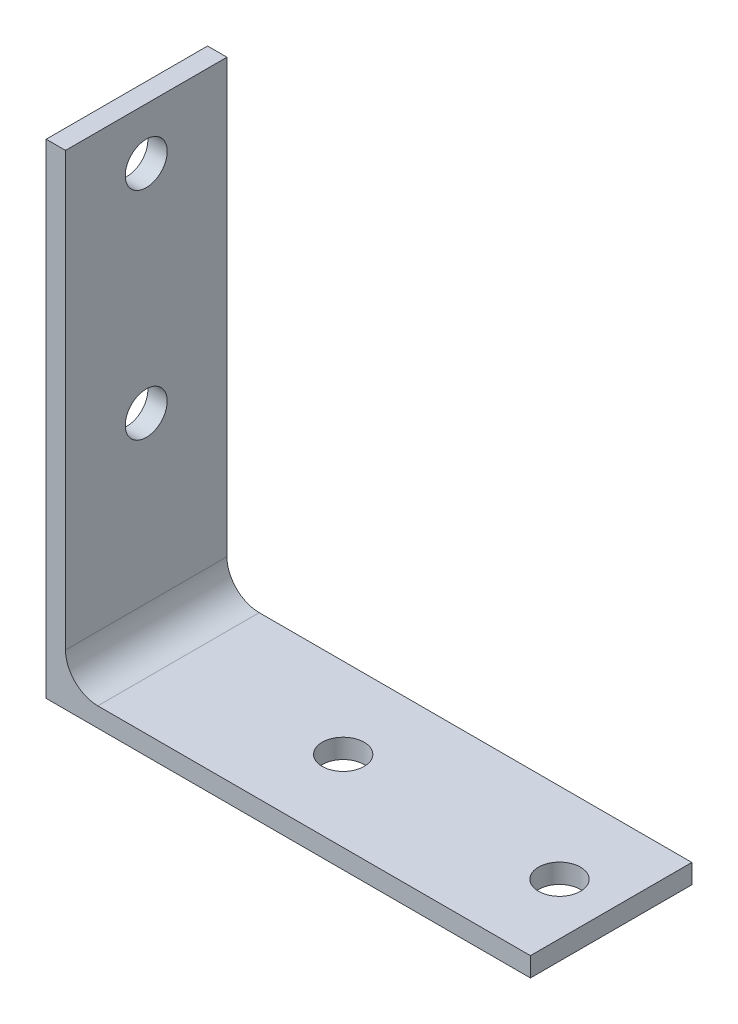
from build123d import *

# Parameters (mm, degrees)
BOSS_EXTRUDE1_DEPTH = 6.35
FILLET1_R           = 2.54
SKETCH2_R           = 1.651
CUT_EXTRUDE1_DEPTH  = 54.195265541
SKETCH3_R           = 1.651
CUT_EXTRUDE2_DEPTH  = 54.195265541


with BuildPart() as part:
    # Sketch1 → Boss-Extrude1 (new, symmetric)
    with BuildSketch(Plane.XY):
        Polygon((0, 0), (38.1, 0), (38.1, 1.524), (36.576, 1.524), (1.524, 1.524), (1.524, 36.576), (1.524, 38.1), (0, 38.1), align=None)
    extrude(amount=BOSS_EXTRUDE1_DEPTH, both=True)

    # Fillet1
    fillet1_edges = [part.edges().sort_by_distance(p)[0] for p in [
        (1.524, 1.524, 0),
    ]]
    fillet(fillet1_edges, radius=FILLET1_R)

    # Sketch2 → Cut-Extrude1 (cut, through all)
    with BuildSketch(Plane(origin=(1.524, 0, 0), x_dir=(0, 0, -1), z_dir=(1, 0, 0))):
        with Locations(Location((0, 34.036, 0), (0, 0, 90))):
            Circle(SKETCH2_R)
        with Locations(Location((0, 17.018, 0), (0, 0, 90))):
            Circle(SKETCH2_R)
    extrude(amount=-CUT_EXTRUDE1_DEPTH, mode=Mode.SUBTRACT)

    # Sketch3 → Cut-Extrude2 (cut, through all)
    with BuildSketch(Plane(origin=(0, 1.524, 0), x_dir=(1, 0, 0), z_dir=(0, 1, 0))):
        with Locations(Location((17.018, 0, 0), (0, 0, 270))):
            Circle(SKETCH3_R)
        with Locations(Location((34.036, 0, 0), (0, 0, 270))):
            Circle(SKETCH3_R)
    extrude(amount=-CUT_EXTRUDE2_DEPTH, mode=Mode.SUBTRACT)


solid = part.part
